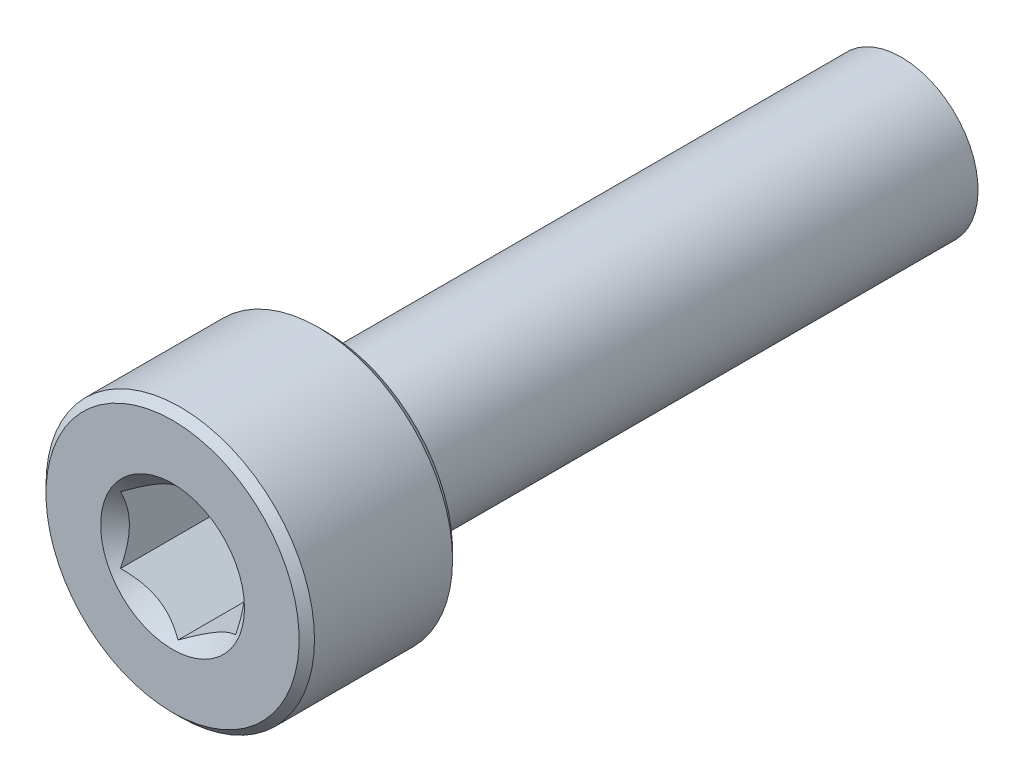
from build123d import *

# Parameters (mm, degrees)
CUT_EXTRUDE1_DEPTH  = 3
BOSS_EXTRUDE1_START = 15
SKETCH12_R          = 2
BOSS_EXTRUDE1_DEPTH = 15


with BuildPart() as part:
    # Sketch2 → Revolve1 (revolve)
    with BuildSketch(Plane(origin=(0, 0, 0), x_dir=(0, 0, -1), z_dir=(1, 0, 0))):
        with BuildLine():
            Line((-7, 0), (-7, 3.3))
            Line((-7, 3.3), (-6.8, 3.5))
            Line((-6.8, 3.5), (-3.2, 3.5))
            Line((-3.2, 3.5), (-3, 3.3))
            Line((-3, 3.3), (-3, 2.2))
            ThreePointArc((-3, 2.2), (-2.941421356, 2.058578644), (-2.8, 2))
            Line((-2.8, 2), (6.545336663, 2))
            Line((6.545336663, 2), (7, 1.545336663))
            Line((7, 1.545336663), (7, 0))
            Line((7, 0), (-7, 0))
        make_face()
    revolve(axis=Axis((0, 0, -7), (0, 0, 1)))

    # Sketch3 → Cut-Extrude1 (cut)
    with BuildSketch(Plane.XY.offset(7)):
        Polygon((1.5, -0.866025404), (1.5, 0.866025404), (0, 1.732050808), (-1.5, 0.866025404), (-1.5, -0.866025404), (0, -1.732050808), align=None)
    extrude(amount=-CUT_EXTRUDE1_DEPTH, mode=Mode.SUBTRACT)

    # Cut-Extrude2 cone 1 section (through the dimple's axis) → Cut-Extrude2 (revolve, cut)
    with BuildSketch(Plane(origin=(0, 0, 7), x_dir=(0, -1, 0), z_dir=(1, 0, 0))):
        Polygon((0, 0), (1.875, 0), (0, 1.875), align=None)
    revolve(axis=Axis((0, 0, 7), (0, 0, -1)), mode=Mode.SUBTRACT)

    # Sketch12 → Boss-Extrude1 (add)
    with BuildSketch(Plane(origin=(0, 0, 3), x_dir=(-1, 0, 0), z_dir=(0, 0, -1)).offset(BOSS_EXTRUDE1_START)):
        with Locations(Location((0, 0, 0), (0, 0, 90))):
            Circle(SKETCH12_R)
    extrude(amount=-BOSS_EXTRUDE1_DEPTH)


solid = part.part
